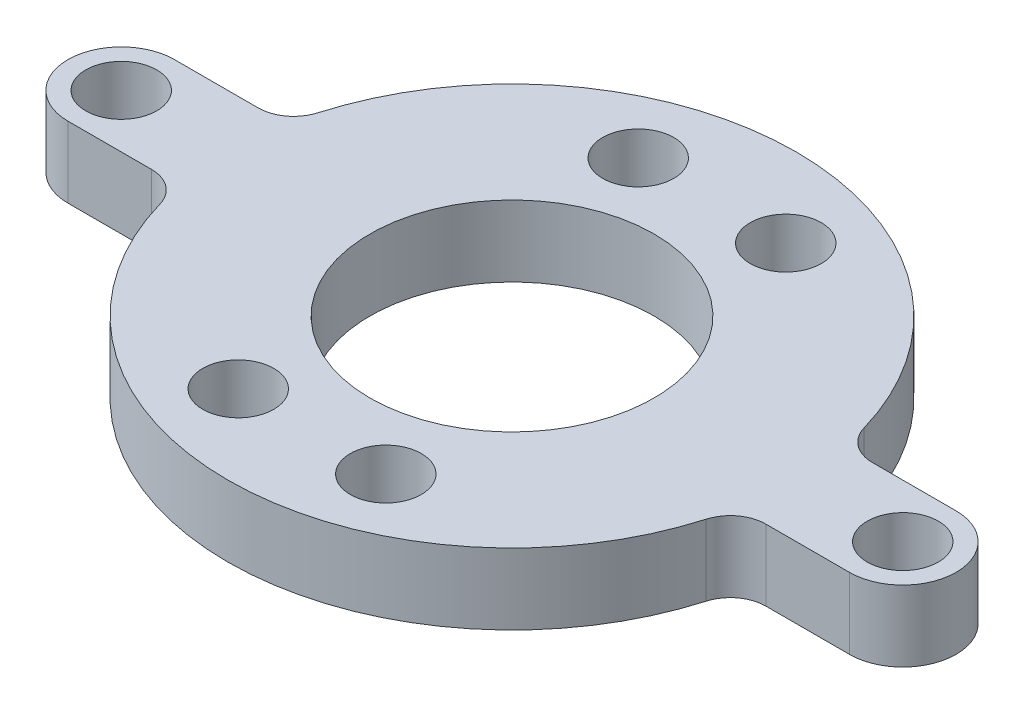
from build123d import *

# Parameters (mm, degrees)
SKETCH1_R           = 20
SKETCH1_R_2         = 5
BOSS_EXTRUDE2_DEPTH = 10


with BuildPart() as part:
    # Sketch1 → Boss-Extrude2 (new body)
    with BuildSketch(Plane(origin=(0, 0, 0), x_dir=(1, 0, 0), z_dir=(0, 1, 0))):
        with BuildLine():
            Line((-55, -7.5), (-43.229041164, -7.5))
            ThreePointArc((-43.229041164, -7.5), (-40.224415102, -8.503473731), (-38.425814368, -11.111111111))
            ThreePointArc((-38.425814368, -11.111111111), (0, -40), (38.425814368, -11.111111111))
            ThreePointArc((38.425814368, -11.111111111), (40.224415102, -8.503473731), (43.229041164, -7.5))
            Line((43.229041164, -7.5), (55, -7.5))
            ThreePointArc((55, -7.5), (62.5, 0), (55, 7.5))
            Line((55, 7.5), (43.229041164, 7.5))
            ThreePointArc((43.229041164, 7.5), (40.224415102, 8.503473731), (38.425814368, 11.111111111))
            ThreePointArc((38.425814368, 11.111111111), (0, 40), (-38.425814368, 11.111111111))
            ThreePointArc((-38.425814368, 11.111111111), (-40.224415102, 8.503473731), (-43.229041164, 7.5))
            Line((-43.229041164, 7.5), (-55, 7.5))
            ThreePointArc((-55, 7.5), (-62.5, 0), (-55, -7.5))
        make_face()
        with Locations(Location((0, 0, 0), (0, 0, 270))):
            Circle(SKETCH1_R, mode=Mode.SUBTRACT)
        with Locations(Location((55, 0, 0), (0, 0, 270))):
            Circle(SKETCH1_R_2, mode=Mode.SUBTRACT)
        with Locations(Location((-55, 0, 0), (0, 0, 90))):
            Circle(SKETCH1_R_2, mode=Mode.SUBTRACT)
        with Locations(Location((10.383511712, 28.145740078, 0), (0, 0, 270))):
            Circle(SKETCH1_R_2, mode=Mode.SUBTRACT)
        with Locations(Location((-10.383511712, 28.145740078, 0), (0, 0, 90))):
            Circle(SKETCH1_R_2, mode=Mode.SUBTRACT)
        with Locations(Location((10.383511712, -28.145740078, 0), (0, 0, 90))):
            Circle(SKETCH1_R_2, mode=Mode.SUBTRACT)
        with Locations(Location((-10.383511712, -28.145740078, 0), (0, 0, 270))):
            Circle(SKETCH1_R_2, mode=Mode.SUBTRACT)
    extrude(amount=BOSS_EXTRUDE2_DEPTH)


solid = part.part
